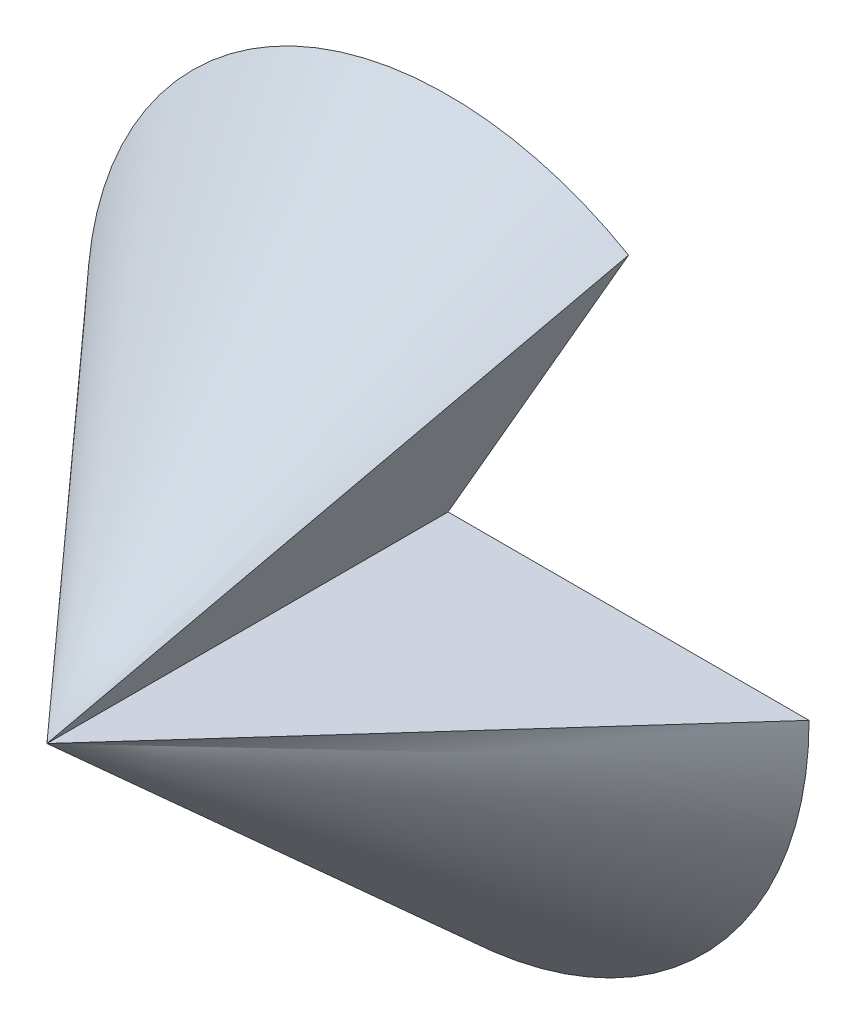
from build123d import *

# Parameters (mm, degrees)
REVOLVE1_ANGLE = 300


with BuildPart() as part:
    # Sketch3 → Revolve1 (revolve)
    with BuildSketch(Plane(origin=(0, 0, 0), x_dir=(1, 0, 0), z_dir=(0, 1, 0))):
        Polygon((0, 0), (45, 0), (0, -50), align=None)
    revolve(axis=Axis((0, 0, 50), (0, 0, -1)), revolution_arc=REVOLVE1_ANGLE)


solid = part.part
